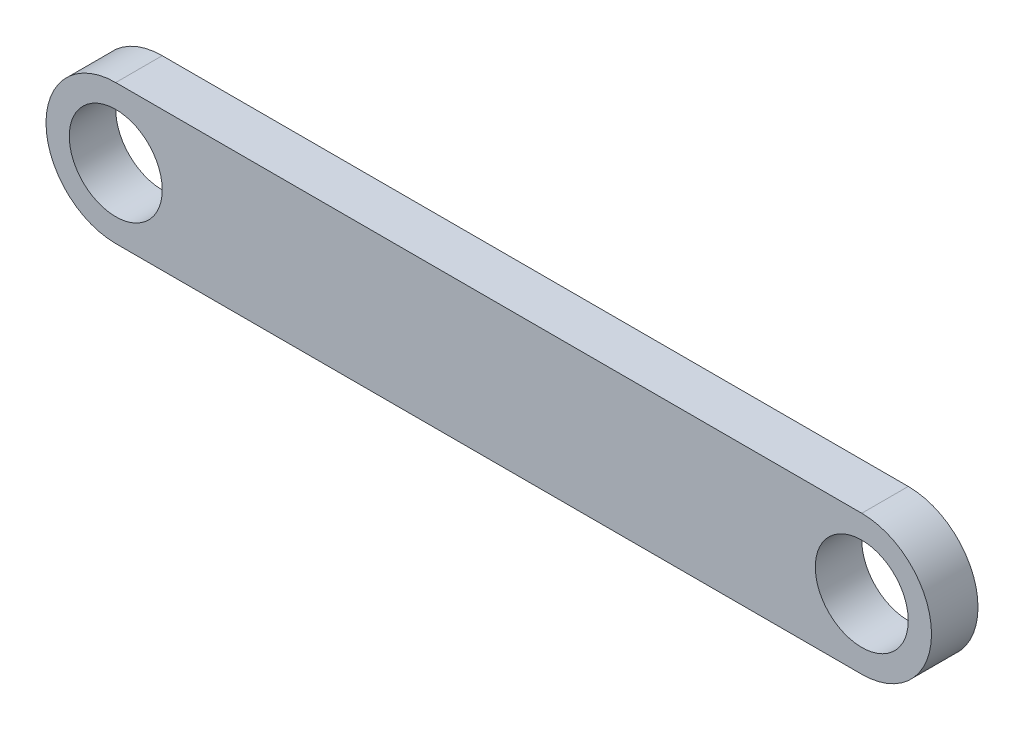
from build123d import *

# Parameters (mm, degrees)
SKETCH1_R           = 1
BOSS_EXTRUDE1_DEPTH = 0.5


with BuildPart() as part:
    # Sketch1 → Boss-Extrude1 (new, symmetric)
    with BuildSketch(Plane.XY):
        with BuildLine():
            Line((0, -1.5), (-16.0465, -1.5))
            ThreePointArc((-16.0465, -1.5), (-17.5465, 0), (-16.0465, 1.5))
            Line((-16.0465, 1.5), (0, 1.5))
            ThreePointArc((0, 1.5), (1.5, 0), (0, -1.5))
        make_face()
        with Locations((-16.0465, 0)):
            Circle(SKETCH1_R, mode=Mode.SUBTRACT)
        Circle(SKETCH1_R, mode=Mode.SUBTRACT)
    extrude(amount=BOSS_EXTRUDE1_DEPTH, both=True)


solid = part.part
